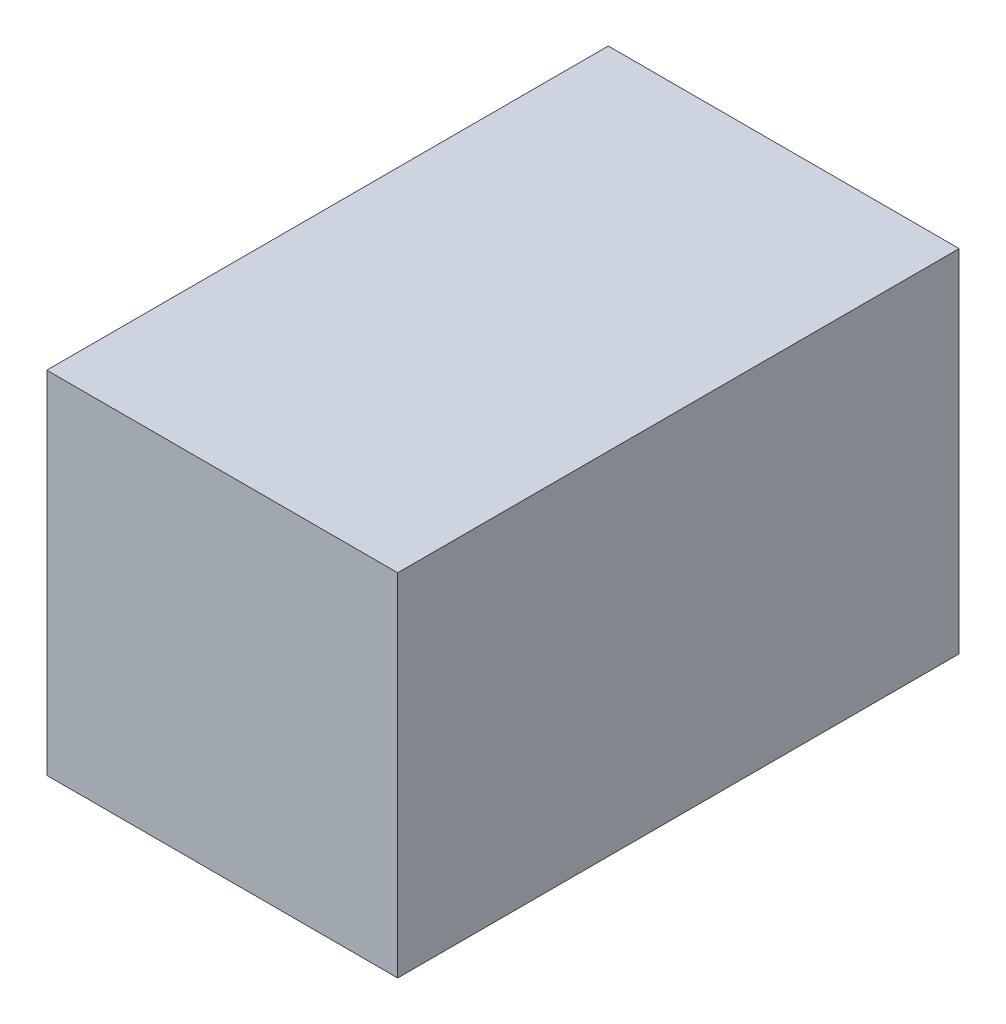
from build123d import *

# Parameters (mm, degrees)
SKETCH1_W                                    = 1524
SKETCH1_H                                    = 1524
ILLUMINANCE_PLANE_2_12_2019_5_16_28_PM_DEPTH = 1219.2


with BuildPart() as part:
    # Sketch1 → Illuminance Plane 2-12-2019 5_16_28 PM (new, symmetric)
    with BuildSketch(Plane.XY):
        Rectangle(SKETCH1_W, SKETCH1_H)
    extrude(amount=ILLUMINANCE_PLANE_2_12_2019_5_16_28_PM_DEPTH, both=True)


solid = part.part
